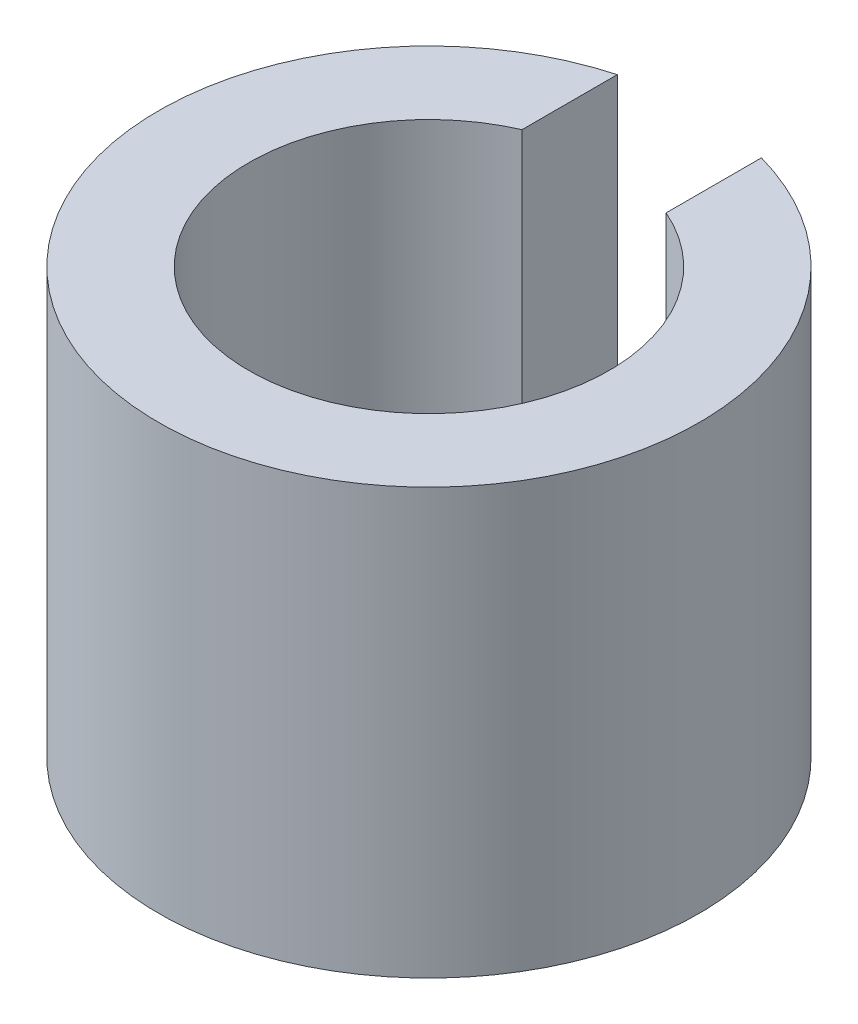
from build123d import *

# Parameters (mm, degrees)
SKETCH1_R           = 7.5
SKETCH1_R_2         = 5
BOSS_EXTRUDE1_DEPTH = 11.8
SKETCH2_W           = 4
SKETCH2_H           = 4
CUT_EXTRUDE1_DEPTH  = 16.866316523


with BuildPart() as part:
    # Sketch1 → Boss-Extrude1 (new body)
    with BuildSketch(Plane(origin=(0, 0, 0), x_dir=(1, 0, 0), z_dir=(0, 1, 0))):
        with Locations(Location((0, 0, 0), (0, 0, 270))):
            Circle(SKETCH1_R)
        with Locations(Location((0, 0, 0), (0, 0, 270))):
            Circle(SKETCH1_R_2, mode=Mode.SUBTRACT)
    extrude(amount=BOSS_EXTRUDE1_DEPTH)

    # Sketch2 → Cut-Extrude1 (cut, through all)
    with BuildSketch(Plane(origin=(0, 11.8, 0), x_dir=(1, 0, 0), z_dir=(0, 1, 0))):
        with Locations((0, 5.942306576)):
            Rectangle(SKETCH2_W, SKETCH2_H)
    extrude(amount=-CUT_EXTRUDE1_DEPTH, mode=Mode.SUBTRACT)


solid = part.part
